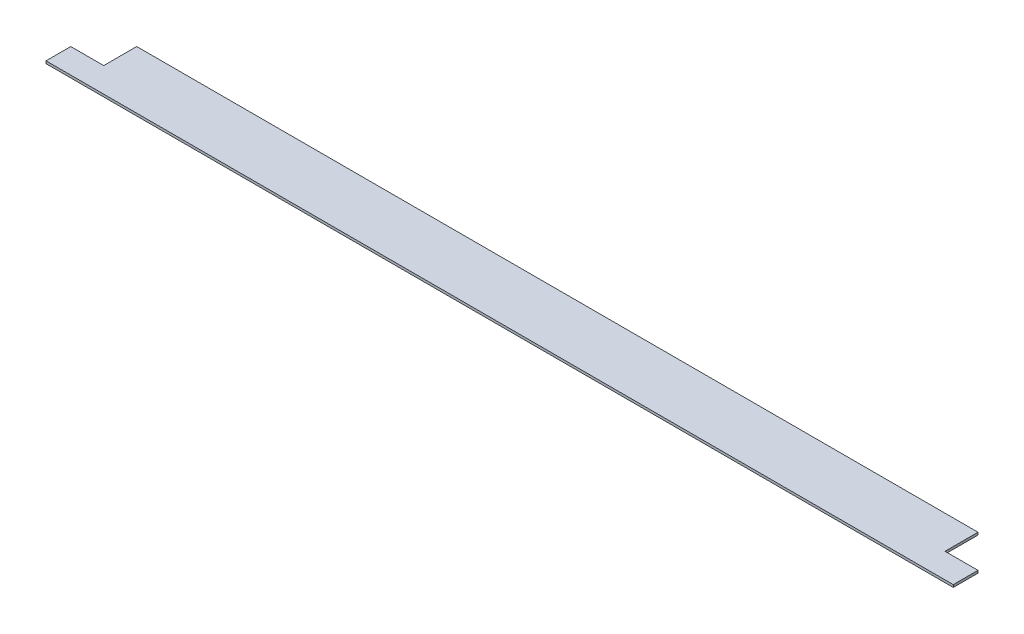
from build123d import *

# Parameters (mm, degrees)
CROQUIS1_W     = 1100
CROQUIS1_H     = 70
EXTRUIR1_DEPTH = 3
CROQUIS2_W     = 40
CROQUIS2_H     = 40
EXTRUIR2_DEPTH = 10


with BuildPart() as part:
    # Croquis1 → Extruir1 (new body)
    with BuildSketch(Plane(origin=(0, 0, 0), x_dir=(1, 0, 0), z_dir=(0, 1, 0))):
        Rectangle(CROQUIS1_W, CROQUIS1_H)
    extrude(amount=EXTRUIR1_DEPTH)

    # Croquis2 → Extruir2 (cut)
    with BuildSketch(Plane(origin=(0, 3, 0), x_dir=(1, 0, 0), z_dir=(0, 1, 0))):
        with Locations((-530, 15)):
            Rectangle(CROQUIS2_W, CROQUIS2_H)
        with Locations((530, 15)):
            Rectangle(CROQUIS2_W, CROQUIS2_H)
    extrude(amount=-EXTRUIR2_DEPTH, mode=Mode.SUBTRACT)


solid = part.part
